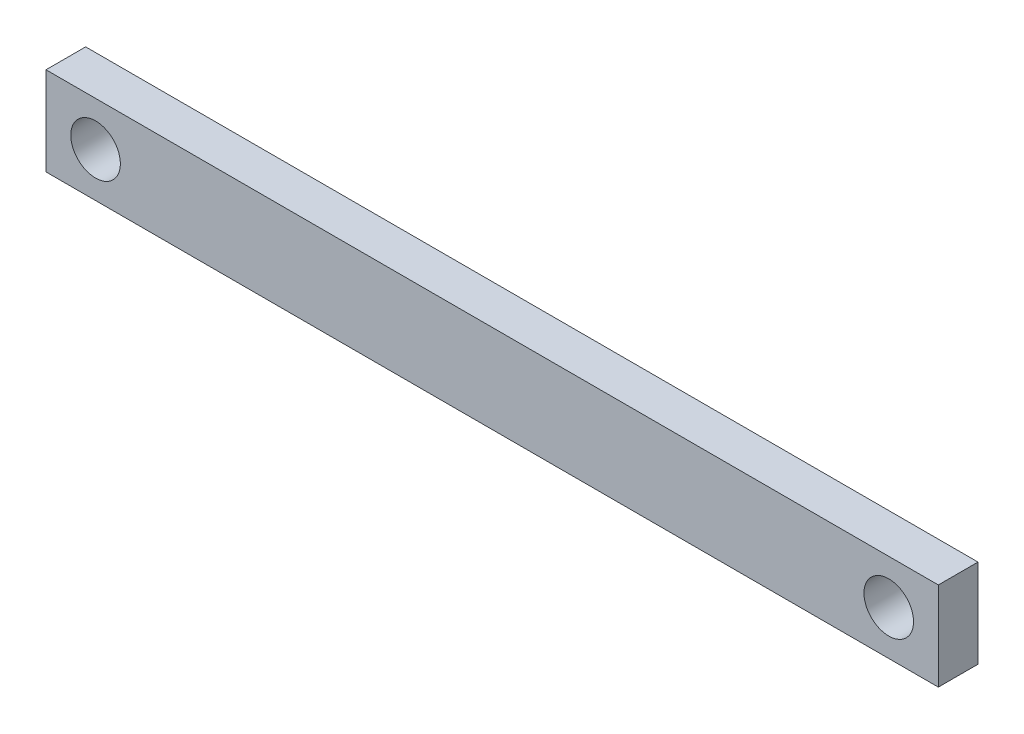
from build123d import *

# Parameters (mm, degrees)
ESQUISSE1_W = 90
ESQUISSE1_H = 8.926229508
ESQUISSE1_R = 2.5
BASE_DEPTH  = 4


with BuildPart() as part:
    # Esquisse1 → BASE (new body)
    with BuildSketch(Plane.XY):
        Rectangle(ESQUISSE1_W, ESQUISSE1_H)
        with Locations((-40, 0)):
            Circle(ESQUISSE1_R, mode=Mode.SUBTRACT)
        with Locations(Location((40, 0, 0), (0, 0, 180))):
            Circle(ESQUISSE1_R, mode=Mode.SUBTRACT)
    extrude(amount=BASE_DEPTH)


solid = part.part
